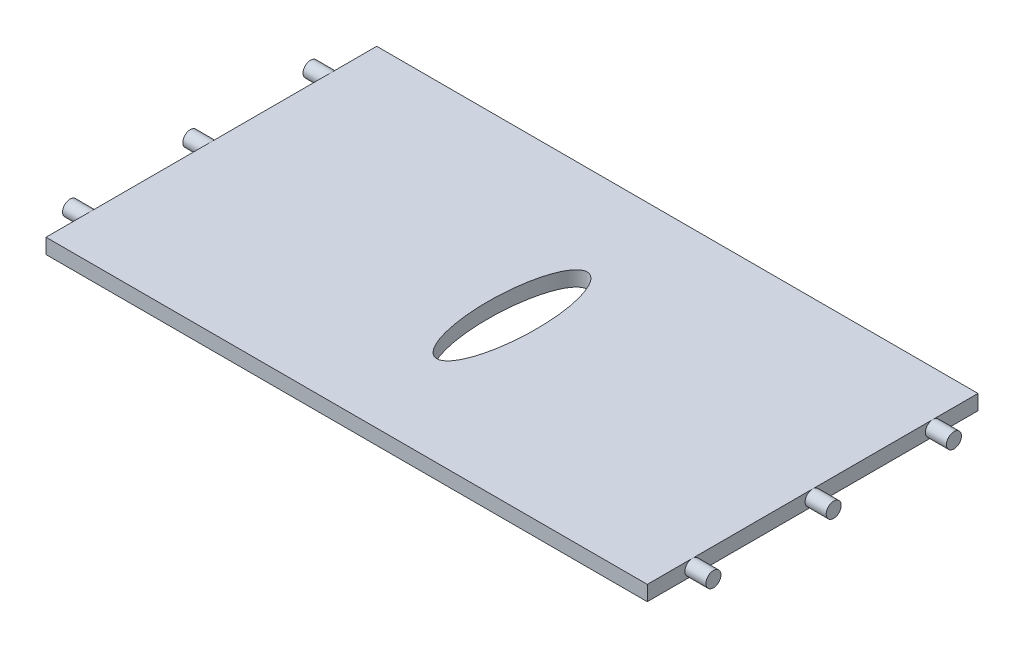
from build123d import *

# Parameters (mm, degrees)
SKETCH1_W                = 200
SKETCH1_H                = 110
BOSS_EXTRUDE1_DEPTH      = 5
BOSS_EXTRUDE2_DEPTH      = 7
BOSS_EXTRUDE2_DEPTH_BACK = 207
SKETCH2_R                = 2.5
SKETCH3_RX               = 25
SKETCH3_RY               = 8
CUT_EXTRUDE1_DEPTH       = 10


with BuildPart() as part:
    # Sketch1 → Boss-Extrude1 (new body)
    with BuildSketch(Plane(origin=(0, 0, 0), x_dir=(1, 0, 0), z_dir=(0, 1, 0))):
        Rectangle(SKETCH1_W, SKETCH1_H)
    extrude(amount=BOSS_EXTRUDE1_DEPTH)

    # Sketch2 → Boss-Extrude2 (add, two sides: drawn at the far end of the back side and taken through both)
    with BuildSketch(Plane.ZY.offset(100).offset(-BOSS_EXTRUDE2_DEPTH_BACK)):
        with Locations((-40, 2.5)):
            Circle(SKETCH2_R)
        with Locations((0, 2.5)):
            Circle(SKETCH2_R)
        with Locations((40, 2.5)):
            Circle(SKETCH2_R)
    extrude(amount=BOSS_EXTRUDE2_DEPTH + BOSS_EXTRUDE2_DEPTH_BACK)

    # Sketch3 → Cut-Extrude1 (cut)
    with BuildSketch(Plane(origin=(0, 5, 0), x_dir=(1, 0, 0), z_dir=(0, 1, 0))):
        with Locations(Location((0, 0), (0, 0, 90))):
            Ellipse(SKETCH3_RX, SKETCH3_RY)
    extrude(amount=-CUT_EXTRUDE1_DEPTH, mode=Mode.SUBTRACT)


solid = part.part
